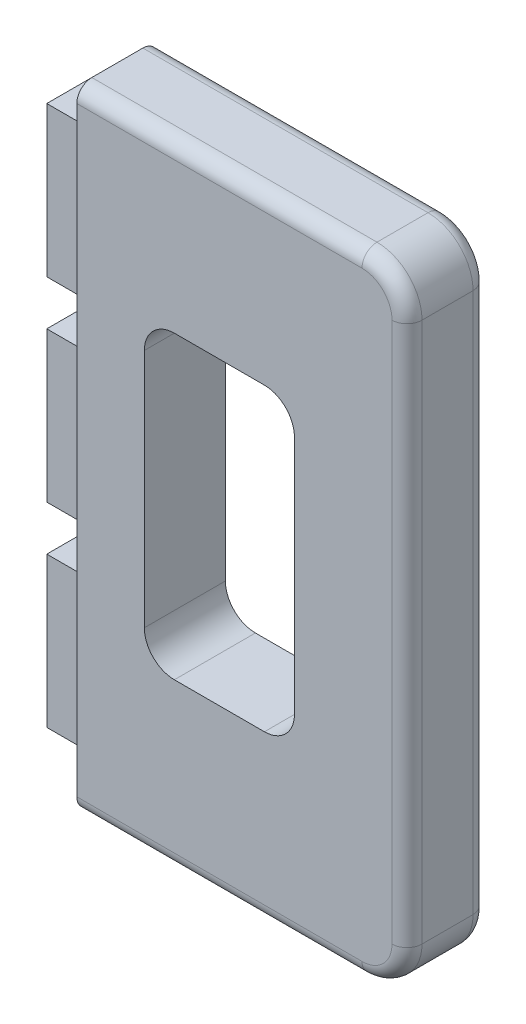
from build123d import *

# Parameters (mm, degrees)
SKETCH1_W                = 50
SKETCH1_H                = 100
BOSS_EXTRUDE4_DEPTH      = 8.5
SKETCH2_W                = 50
SKETCH2_H                = 100
BOSS_EXTRUDE5_DEPTH      = 5
BOSS_EXTRUDE6_START      = 5
SKETCH3_W                = 50
SKETCH3_H                = 100
BOSS_EXTRUDE6_DEPTH      = 5
FILLET3_R                = 10
M5_CLEARANCE_HOLE1_D     = 5.3
M5_CLEARANCE_HOLE1_DEPTH = 15
M5_CLEARANCE_HOLE1_TIP   = 1.59228064
FILLET2_R                = 5


with BuildPart() as part:
    # Sketch1 → Boss-Extrude4 (new, symmetric)
    with BuildSketch(Plane.XY):
        with BuildLine():
            Line((0, -25), (0, 25))
            Line((0, 25), (15, 25))
            Line((15, 25), (15, 40))
            Line((15, 40), (0, 40))
            Line((0, 40), (0, 90))
            Line((0, 90), (15, 90))
            Line((15, 90), (15, 105))
            Line((15, 105), (110, 105))
            ThreePointArc((110, 105), (120.606601718, 100.606601718), (125, 90))
            Line((125, 90), (125, -90))
            ThreePointArc((125, -90), (120.606601718, -100.606601718), (110, -105))
            Line((110, -105), (15, -105))
            Line((15, -105), (15, -90))
            Line((15, -90), (0, -90))
            Line((0, -90), (0, -40))
            Line((0, -40), (15, -40))
            Line((15, -40), (15, -25))
            Line((15, -25), (0, -25))
        make_face()
        with Locations((62.5, 0)):
            Rectangle(SKETCH1_W, SKETCH1_H, mode=Mode.SUBTRACT)
    extrude(amount=BOSS_EXTRUDE4_DEPTH, both=True)

    # Sketch2 → Boss-Extrude5 (add)
    with BuildSketch(Plane(origin=(0, 0, -8.5), x_dir=(-1, 0, 0), z_dir=(0, 0, -1))):
        with BuildLine():
            Line((-110, 105), (-15, 105))
            Line((-15, 105), (-15, 90))
            Line((-15, 90), (-15, 40))
            Line((-15, 40), (-15, 25))
            Line((-15, 25), (-15, -25))
            Line((-15, -25), (-15, -40))
            Line((-15, -40), (-15, -90))
            Line((-15, -90), (-15, -105))
            Line((-15, -105), (-110, -105))
            ThreePointArc((-110, -105), (-120.606601718, -100.606601718), (-125, -90))
            Line((-125, -90), (-125, 90))
            ThreePointArc((-125, 90), (-120.606601718, 100.606601718), (-110, 105))
        make_face()
        with Locations((-62.5, 0)):
            Rectangle(SKETCH2_W, SKETCH2_H, mode=Mode.SUBTRACT)
    extrude(amount=BOSS_EXTRUDE5_DEPTH)

    # Sketch3 → Boss-Extrude6 (add)
    with BuildSketch(Plane.XY.offset(8.5).offset(BOSS_EXTRUDE6_START)):
        with BuildLine():
            Line((15, -90), (15, -105))
            Line((15, -105), (110, -105))
            ThreePointArc((110, -105), (120.606601718, -100.606601718), (125, -90))
            Line((125, -90), (125, 90))
            ThreePointArc((125, 90), (120.606601718, 100.606601718), (110, 105))
            Line((110, 105), (15, 105))
            Line((15, 105), (15, 90))
            Line((15, 90), (15, 40))
            Line((15, 40), (15, 25))
            Line((15, 25), (15, -25))
            Line((15, -25), (15, -40))
            Line((15, -40), (15, -90))
        make_face()
        with Locations((62.5, 0)):
            Rectangle(SKETCH3_W, SKETCH3_H, mode=Mode.SUBTRACT)
    extrude(amount=-BOSS_EXTRUDE6_DEPTH)

    # Fillet3
    fillet3_edges = [part.edges().sort_by_distance(p)[0] for p in [
        (37.5, 50, 0),
        (37.5, -50, 0),
        (87.5, -50, 0),
        (87.5, 50, 0),
    ]]
    fillet(fillet3_edges, radius=FILLET3_R)

    # M5 Clearance Hole1
    with Locations(Plane(origin=(62.5, 60, -13.5), x_dir=(-1, 0, 0), z_dir=(0, 0, -1))):
        with Locations((0, 0), (0, -120)):
            Hole(M5_CLEARANCE_HOLE1_D / 2, depth=M5_CLEARANCE_HOLE1_DEPTH)
            with Locations((0, 0, -(M5_CLEARANCE_HOLE1_DEPTH + M5_CLEARANCE_HOLE1_TIP / 2))):  # 118° drill point
                Cone(0, M5_CLEARANCE_HOLE1_D / 2, M5_CLEARANCE_HOLE1_TIP, mode=Mode.SUBTRACT)

    # Fillet2
    fillet2_edges = [part.edges().sort_by_distance(p)[0] for p in [
        (62.5, -105, 13.5),
        (120.606601718, -100.606601718, 13.5),
        (125, 0, 13.5),
        (120.606601718, 100.606601718, 13.5),
        (62.5, 105, 13.5),
        (120.606601718, 100.606601718, -13.5),
        (125, 0, -13.5),
        (120.606601718, -100.606601718, -13.5),
        (62.5, -105, -13.5),
        (62.5, 105, -13.5),
    ]]
    fillet(fillet2_edges, radius=FILLET2_R)


solid = part.part
